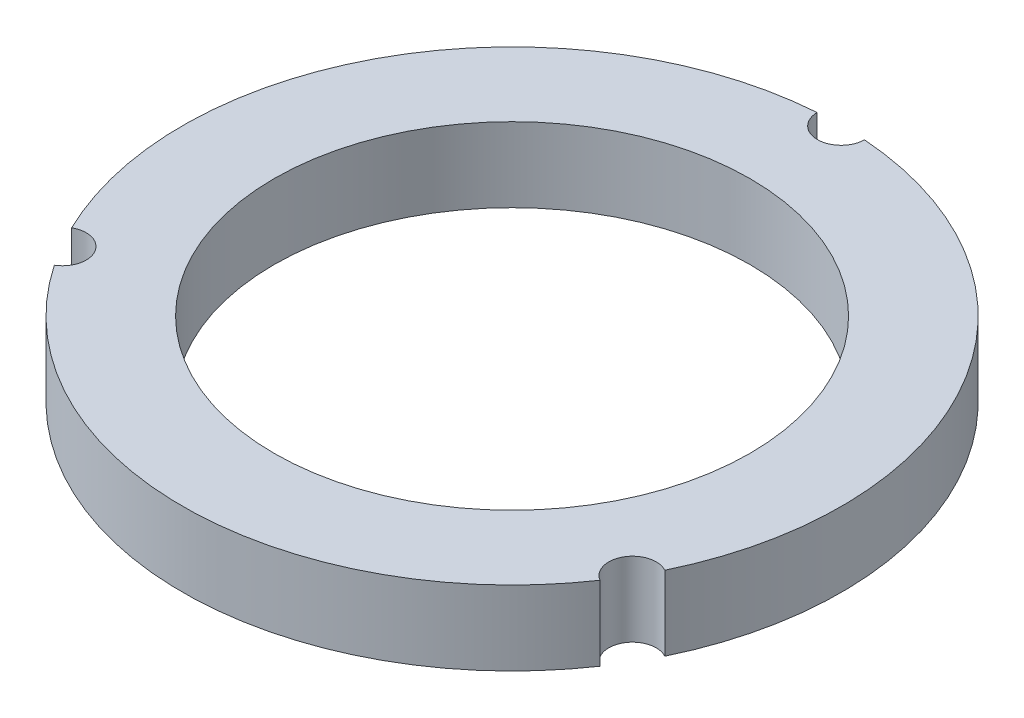
from build123d import *

# Parameters (mm, degrees)
SKETCH1_R           = 10
SKETCH1_R_2         = 7.22
BOSS_EXTRUDE1_DEPTH = 2.26
SKETCH2_R           = 0.72
CUT_EXTRUDE1_DEPTH  = 15.321578125


with BuildPart() as part:
    # Sketch1 → Boss-Extrude1 (new body)
    with BuildSketch(Plane(origin=(0, 0, 0), x_dir=(1, 0, 0), z_dir=(0, 1, 0))):
        with Locations(Location((0, 0, 0), (0, 0, 270))):
            Circle(SKETCH1_R)
        with Locations(Location((0, 0, 0), (0, 0, 270))):
            Circle(SKETCH1_R_2, mode=Mode.SUBTRACT)
    extrude(amount=BOSS_EXTRUDE1_DEPTH)

    # Sketch2 → Cut-Extrude1 (cut, through all)
    with BuildSketch(Plane(origin=(0, 2.26, 0), x_dir=(1, 0, 0), z_dir=(0, 1, 0))):
        with Locations((8.648447977, -4.993183768)):
            Circle(SKETCH2_R)
        with Locations((0, 9.986367535)):
            Circle(SKETCH2_R)
        with Locations((-8.648447977, -4.993183768)):
            Circle(SKETCH2_R)
    extrude(amount=-CUT_EXTRUDE1_DEPTH, mode=Mode.SUBTRACT)


solid = part.part
